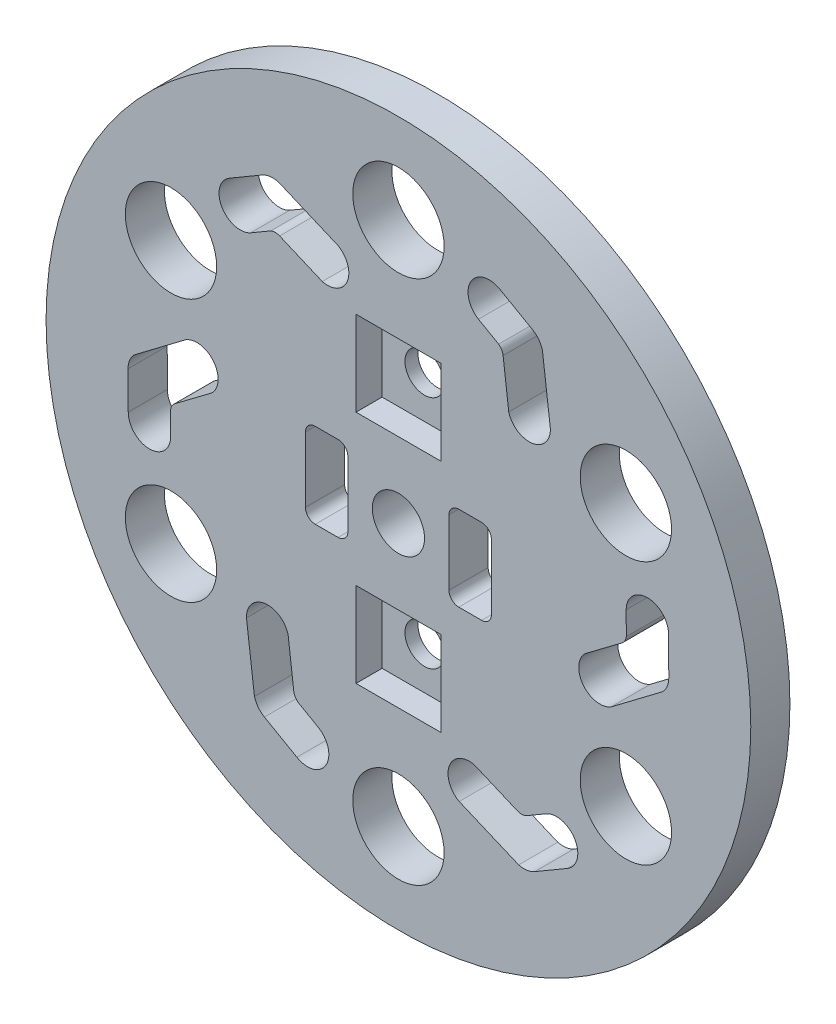
from build123d import *

# Parameters (mm, degrees)
MODEL_R                 = 27
MODEL_R_2               = 1.5
MODEL_R_3               = 3.5
MODEL_R_4               = 2
SALIENTE_EXTRUIR1_DEPTH = 3
CROQUIS2_W              = 6.5
CROQUIS2_H              = 6.5
CORTAR_EXTRUIR1_DEPTH   = 2


with BuildPart() as part:
    # Model → Saliente-Extruir1 (new body)
    with BuildSketch(Plane.XY):
        with Locations((216.74059699, 240.760681356)):
            Circle(MODEL_R)
        with Locations((216.74059699, 249.760681356)):
            Circle(MODEL_R_2, mode=Mode.SUBTRACT)
        with BuildLine():
            ThreePointArc((208.719111811, 225.617882009), (208.829996246, 225.28915626), (209.06215237, 225.03135884))
            Line((209.06215237, 225.03135884), (210.608223397, 224.148384774))
            ThreePointArc((210.608223397, 224.148384774), (211.183432146, 221.923579716), (208.958627088, 221.348370966))
            Line((208.958627088, 221.348370966), (206.468987847, 222.769480989))
            ThreePointArc((206.468987847, 222.769480989), (205.990273761, 223.185226154), (205.707098402, 223.752520553))
            Line((205.707098402, 223.752520553), (205.097225271, 228.664367063))
            ThreePointArc((205.097225271, 228.664367063), (206.481118716, 230.320700093), (208.289058497, 229.141737021))
            Line((208.289058497, 229.141737021), (208.719111811, 225.617882009))
        make_face(mode=Mode.SUBTRACT)
        with Locations((199.312171932, 230.698375457)):
            Circle(MODEL_R_3, mode=Mode.SUBTRACT)
        with BuildLine():
            ThreePointArc((199.615805481, 240.136091624), (199.38656285, 239.875700011), (199.279381797, 239.5457482))
            Line((199.279381797, 239.5457482), (199.287739338, 237.765324382))
            ThreePointArc((199.287739338, 237.765324382), (197.648606014, 236.154776464), (196.038058096, 237.793909788))
            Line((196.038058096, 237.793909788), (196.023955856, 240.660555628))
            ThreePointArc((196.023955856, 240.660555628), (196.144644688, 241.283006771), (196.494348369, 241.811891025))
            Line((196.494348369, 241.811891025), (200.44319566, 244.795979904))
            ThreePointArc((200.44319566, 244.795979904), (202.569568865, 244.42565954), (202.452526784, 242.270456224))
            Line((202.452526784, 242.270456224), (199.615805481, 240.136091624))
        make_face(mode=Mode.SUBTRACT)
        with Locations((216.74059699, 220.636069558)):
            Circle(MODEL_R_3, mode=Mode.SUBTRACT)
        with BuildLine():
            ThreePointArc((225.84390332, 226.242471741), (226.184030387, 226.174137605), (226.523367563, 226.246291995))
            Line((226.523367563, 226.246291995), (228.061081049, 227.143741747))
            ThreePointArc((228.061081049, 227.143741747), (230.275423122, 226.529484608), (229.661165983, 224.315142535))
            Line((229.661165983, 224.315142535), (227.185628981, 222.869606716))
            ThreePointArc((227.185628981, 222.869606716), (226.586226063, 222.662900739), (225.953347023, 222.701310884))
            Line((225.953347023, 222.701310884), (221.3946266, 224.629068514))
            ThreePointArc((221.3946266, 224.629068514), (220.652146842, 226.65572191), (222.577128703, 227.631962152))
            Line((222.577128703, 227.631962152), (225.84390332, 226.242471741))
        make_face(mode=Mode.SUBTRACT)
        with Locations((234.169022048, 230.698375457)):
            Circle(MODEL_R_3, mode=Mode.SUBTRACT)
        with Locations((199.312171932, 250.822987255)):
            Circle(MODEL_R_3, mode=Mode.SUBTRACT)
        with BuildLine():
            ThreePointArc((209.61559699, 243.260681356), (209.835266904, 243.791011442), (210.36559699, 244.010681356))
            Line((210.36559699, 244.010681356), (212.11559699, 244.010681356))
            ThreePointArc((212.11559699, 244.010681356), (212.645927076, 243.791011442), (212.86559699, 243.260681356))
            Line((212.86559699, 243.260681356), (212.86559699, 238.260681356))
            ThreePointArc((212.86559699, 238.260681356), (212.645927076, 237.73035127), (212.11559699, 237.510681356))
            Line((212.11559699, 237.510681356), (210.36559699, 237.510681356))
            ThreePointArc((210.36559699, 237.510681356), (209.835266904, 237.73035127), (209.61559699, 238.260681356))
            Line((209.61559699, 238.260681356), (209.61559699, 243.260681356))
        make_face(mode=Mode.SUBTRACT)
        with BuildLine():
            ThreePointArc((207.637290661, 255.278890971), (207.297163594, 255.347225107), (206.957826417, 255.275070717))
            Line((206.957826417, 255.275070717), (205.420112932, 254.377620965))
            ThreePointArc((205.420112932, 254.377620965), (203.205770858, 254.991878104), (203.820027998, 257.206220177))
            Line((203.820027998, 257.206220177), (206.295564999, 258.651755995))
            ThreePointArc((206.295564999, 258.651755995), (206.894967917, 258.858461972), (207.527846958, 258.820051828))
            Line((207.527846958, 258.820051828), (212.08656738, 256.892294198))
            ThreePointArc((212.08656738, 256.892294198), (212.829047139, 254.865640802), (210.904065277, 253.889400559))
            Line((210.904065277, 253.889400559), (207.637290661, 255.278890971))
        make_face(mode=Mode.SUBTRACT)
        with Locations((216.74059699, 240.760681356)):
            Circle(MODEL_R_4, mode=Mode.SUBTRACT)
        with BuildLine():
            Line((221.36559699, 244.010681356), (223.11559699, 244.010681356))
            ThreePointArc((223.11559699, 244.010681356), (223.645927076, 243.791011442), (223.86559699, 243.260681356))
            Line((223.86559699, 243.260681356), (223.86559699, 238.260681356))
            ThreePointArc((223.86559699, 238.260681356), (223.645927076, 237.73035127), (223.11559699, 237.510681356))
            Line((223.11559699, 237.510681356), (221.36559699, 237.510681356))
            ThreePointArc((221.36559699, 237.510681356), (220.835266904, 237.73035127), (220.61559699, 238.260681356))
            Line((220.61559699, 238.260681356), (220.61559699, 243.260681356))
            ThreePointArc((220.61559699, 243.260681356), (220.835266904, 243.791011442), (221.36559699, 244.010681356))
        make_face(mode=Mode.SUBTRACT)
        with BuildLine():
            ThreePointArc((227.012206134, 258.751881723), (227.49092022, 258.336136558), (227.774095579, 257.768842159))
            Line((227.774095579, 257.768842159), (228.38396871, 252.856995649))
            ThreePointArc((228.38396871, 252.856995649), (227.000075264, 251.200662618), (225.192135483, 252.379625691))
            Line((225.192135483, 252.379625691), (224.76208217, 255.903480703))
            ThreePointArc((224.76208217, 255.903480703), (224.651197734, 256.232206452), (224.41904161, 256.490003872))
            Line((224.41904161, 256.490003872), (222.872970584, 257.372977938))
            ThreePointArc((222.872970584, 257.372977938), (222.297761834, 259.597782996), (224.522566892, 260.172991745))
            Line((224.522566892, 260.172991745), (227.012206134, 258.751881723))
        make_face(mode=Mode.SUBTRACT)
        with BuildLine():
            ThreePointArc((233.865388499, 241.385271088), (234.09463113, 241.6456627), (234.201812184, 241.975614511))
            Line((234.201812184, 241.975614511), (234.193454642, 243.75603833))
            ThreePointArc((234.193454642, 243.75603833), (235.832587966, 245.366586248), (237.443135884, 243.727452924))
            Line((237.443135884, 243.727452924), (237.457238125, 240.860807084))
            ThreePointArc((237.457238125, 240.860807084), (237.336549293, 240.238355941), (236.986845611, 239.709471687))
            Line((236.986845611, 239.709471687), (233.03799832, 236.725382808))
            ThreePointArc((233.03799832, 236.725382808), (230.911625115, 237.095703172), (231.028667196, 239.250906488))
            Line((231.028667196, 239.250906488), (233.865388499, 241.385271088))
        make_face(mode=Mode.SUBTRACT)
        with Locations((234.169022048, 250.822987255)):
            Circle(MODEL_R_3, mode=Mode.SUBTRACT)
        with Locations((216.74059699, 260.885293153)):
            Circle(MODEL_R_3, mode=Mode.SUBTRACT)
        with Locations((216.74059699, 231.760681356)):
            Circle(MODEL_R_2, mode=Mode.SUBTRACT)
    extrude(amount=SALIENTE_EXTRUIR1_DEPTH)

    # Croquis2 → Cortar-Extruir1 (cut)
    with BuildSketch(Plane.XY.offset(3)):
        with Locations((216.74059699, 249.760681356)):
            Rectangle(CROQUIS2_W, CROQUIS2_H)
        with Locations((216.74059699, 231.760681356)):
            Rectangle(CROQUIS2_W, CROQUIS2_H)
    extrude(amount=-CORTAR_EXTRUIR1_DEPTH, mode=Mode.SUBTRACT)


solid = part.part
